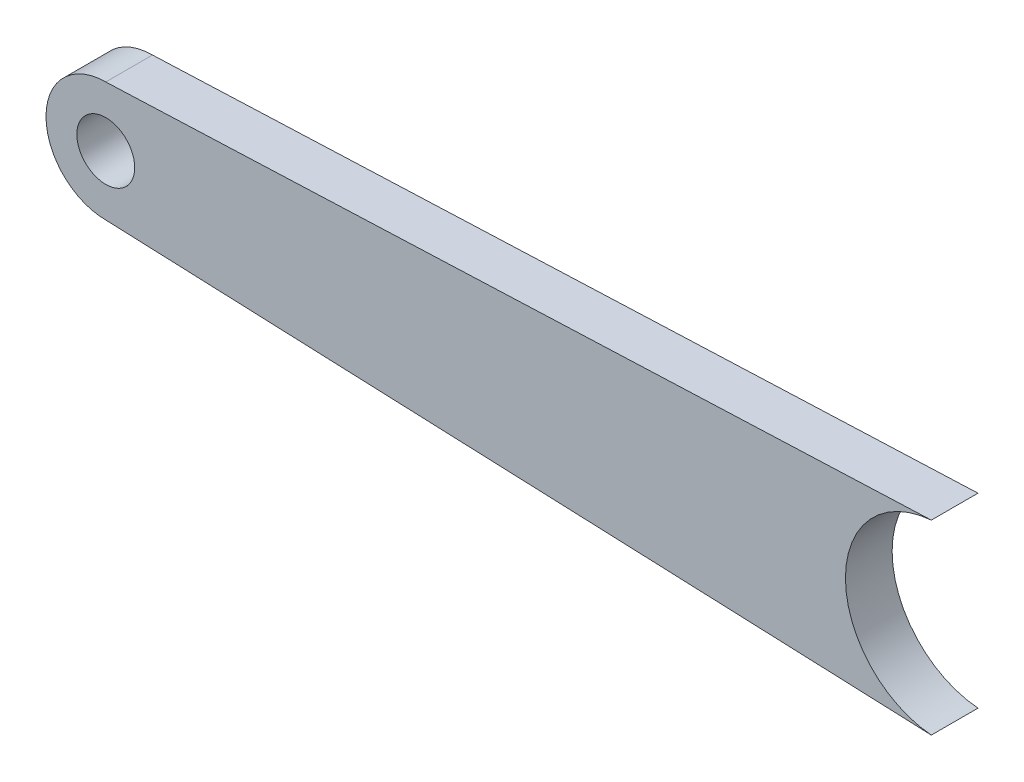
from build123d import *

# Parameters (mm, degrees)
SKETCH1_R           = 8.128
SKETCH1_R_2         = 3.937
BOSS_EXTRUDE1_DEPTH = 6.35
BOSS_EXTRUDE2_START = -6.35
BOSS_EXTRUDE2_DEPTH = 6.35


with BuildPart() as part:
    # Sketch1 → Boss-Extrude1 (new body)
    with BuildSketch(Plane.XY):
        Circle(SKETCH1_R)
        Circle(SKETCH1_R_2, mode=Mode.SUBTRACT)
    extrude(amount=BOSS_EXTRUDE1_DEPTH)

    # Sketch2 → Boss-Extrude2 (add)
    with BuildSketch(Plane.XY.offset(6.35).offset(BOSS_EXTRUDE2_START)):
        with BuildLine():
            Line((112.260554909, 12.658695041), (0, 8.128))
            ThreePointArc((0, 8.128), (5.747363917, 5.747363917), (8.128, 0))
            ThreePointArc((8.128, 0), (5.747363917, -5.747363917), (0, -8.128))
            Line((0, -8.128), (112.260554909, -12.658695041))
            ThreePointArc((112.260554909, -12.658695041), (100.584, 0), (112.260554909, 12.658695041))
        make_face()
    extrude(amount=BOSS_EXTRUDE2_DEPTH)


solid = part.part
